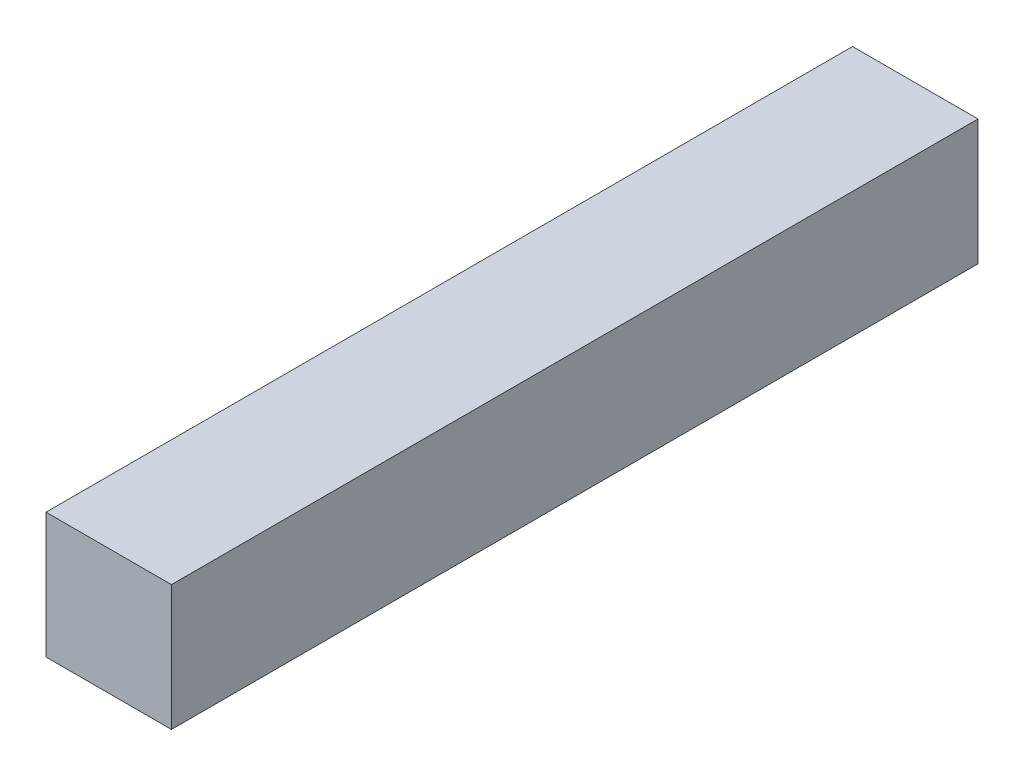
from build123d import *

# Parameters (mm, degrees)
SKETCH1_W           = 2.8
SKETCH1_H           = 2.8
BOSS_EXTRUDE1_DEPTH = 18


with BuildPart() as part:
    # Sketch1 → Boss-Extrude1 (new body)
    with BuildSketch(Plane.XY):
        with Locations((1.4, 1.4)):
            Rectangle(SKETCH1_W, SKETCH1_H)
    extrude(amount=BOSS_EXTRUDE1_DEPTH)


solid = part.part
